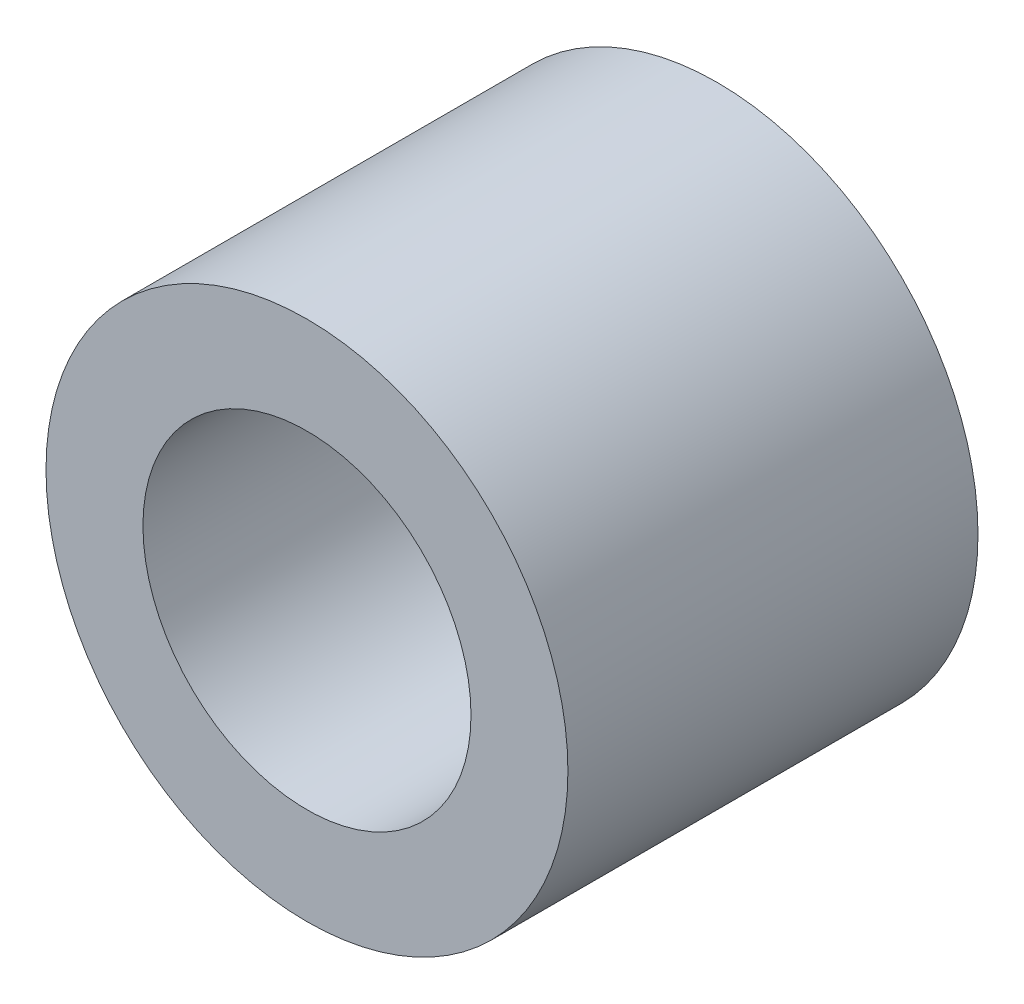
from build123d import *

# Parameters (mm, degrees)
SKETCH1_R           = 7
SKETCH1_R_2         = 4.4
BOSS_EXTRUDE1_DEPTH = 11


with BuildPart() as part:
    # Sketch1 → Boss-Extrude1 (new body)
    with BuildSketch(Plane.XY):
        Circle(SKETCH1_R)
        Circle(SKETCH1_R_2, mode=Mode.SUBTRACT)
    extrude(amount=BOSS_EXTRUDE1_DEPTH)


solid = part.part
